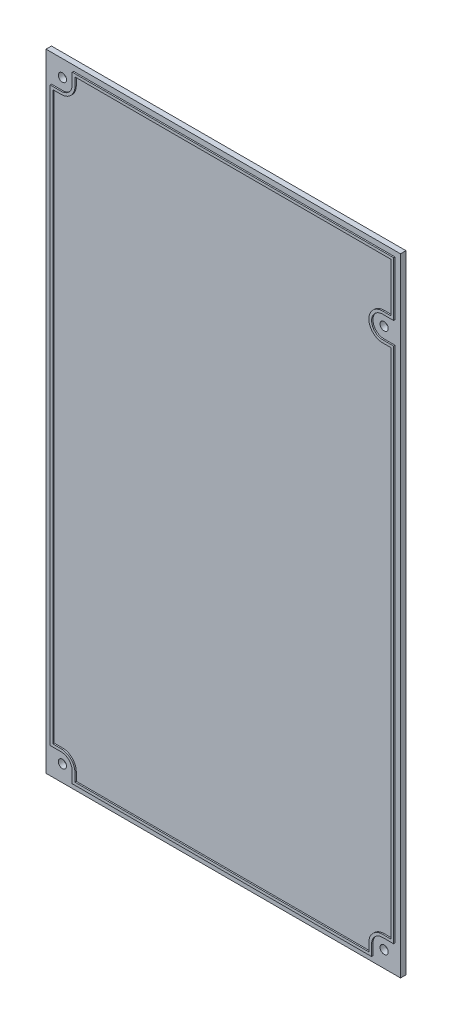
from build123d import *

# Parameters (mm, degrees)
SKETCH1_W           = 130
SKETCH1_H           = 230
BOSS_EXTRUDE1_DEPTH = 2
EXTRUDE_THIN1_DEPTH = 0.5
SKETCH3_R           = 1.5
CUT_EXTRUDE1_DEPTH  = 133.113587492


with BuildPart() as part:
    # Sketch1 → Boss-Extrude1 (new body)
    with BuildSketch(Plane.XY):
        Rectangle(SKETCH1_W, SKETCH1_H)
    extrude(amount=BOSS_EXTRUDE1_DEPTH)

    # Sketch2 → Extrude-Thin1 (add)
    with BuildSketch(Plane.XY.offset(2)):
        with BuildLine():
            Line((58.95, 84.95), (63, 84.95))
            Line((63, 84.95), (63, -104.9))
            Line((63, -104.9), (58.95, -104.9))
            ThreePointArc((58.95, -104.9), (56.086217536, -106.086217536), (54.9, -108.95))
            Line((54.9, -108.95), (54.9, -113))
            Line((54.9, -113), (-54.9, -113))
            Line((-54.9, -113), (-54.9, -108.95))
            ThreePointArc((-54.9, -108.95), (-56.086217536, -106.086217536), (-58.95, -104.9))
            Line((-58.95, -104.9), (-63, -104.9))
            Line((-63, -104.9), (-63, 104.9))
            Line((-63, 104.9), (-58.95, 104.9))
            ThreePointArc((-58.95, 104.9), (-56.086217536, 106.086217536), (-54.9, 108.95))
            Line((-54.9, 108.95), (-54.9, 113))
            Line((-54.9, 113), (63, 113))
            Line((63, 113), (63, 93.05))
            Line((63, 93.05), (58.95, 93.05))
            ThreePointArc((58.95, 93.05), (54.9, 89), (58.95, 84.95))
        make_face()
        with BuildLine():
            Line((58.95, 83.95), (62, 83.95))
            Line((62, 83.95), (62, -103.9))
            Line((62, -103.9), (58.95, -103.9))
            ThreePointArc((58.95, -103.9), (55.379110755, -105.379110755), (53.9, -108.95))
            Line((53.9, -108.95), (53.9, -112))
            Line((53.9, -112), (-53.9, -112))
            Line((-53.9, -112), (-53.9, -108.95))
            ThreePointArc((-53.9, -108.95), (-55.379110755, -105.379110755), (-58.95, -103.9))
            Line((-58.95, -103.9), (-62, -103.9))
            Line((-62, -103.9), (-62, 103.9))
            Line((-62, 103.9), (-58.95, 103.9))
            ThreePointArc((-58.95, 103.9), (-55.379110755, 105.379110755), (-53.9, 108.95))
            Line((-53.9, 108.95), (-53.9, 112))
            Line((-53.9, 112), (62, 112))
            Line((62, 112), (62, 94.05))
            Line((62, 94.05), (58.95, 94.05))
            ThreePointArc((58.95, 94.05), (53.9, 89), (58.95, 83.95))
        make_face(mode=Mode.SUBTRACT)
    extrude(amount=EXTRUDE_THIN1_DEPTH)

    # Sketch3 → Cut-Extrude1 (cut, through all)
    with BuildSketch(Plane.XY.offset(2)):
        with Locations((59, -109)):
            Circle(SKETCH3_R)
        with Locations((-59, -109)):
            Circle(SKETCH3_R)
        with Locations((-59, 109)):
            Circle(SKETCH3_R)
        with Locations((59, 89)):
            Circle(SKETCH3_R)
    extrude(amount=-CUT_EXTRUDE1_DEPTH, mode=Mode.SUBTRACT)


solid = part.part
